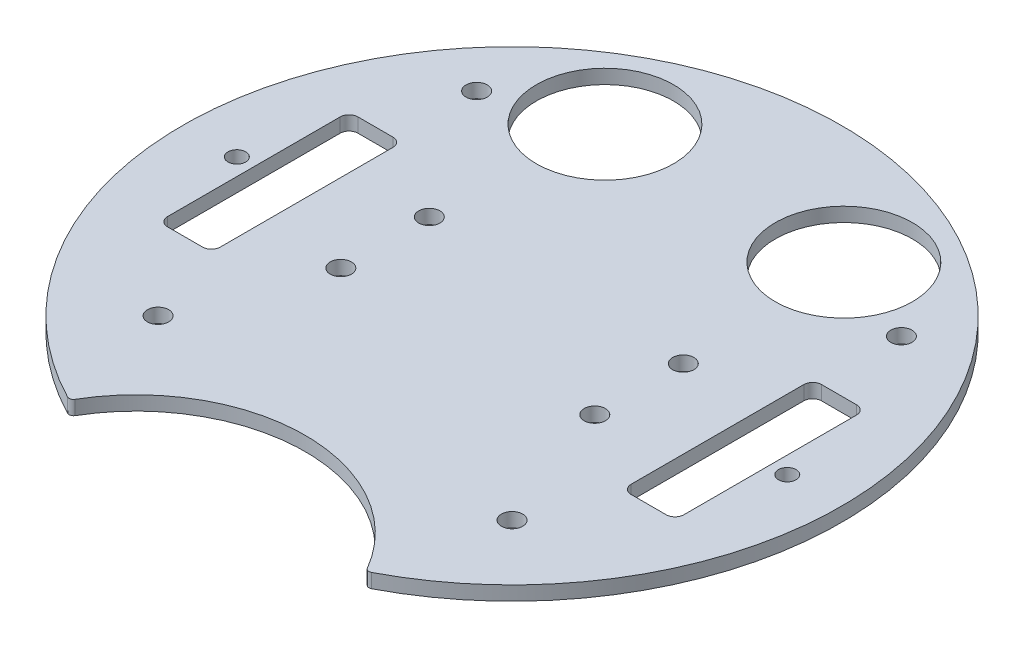
from build123d import *

# Parameters (mm, degrees)
BOSS_EXTRUDE1_DEPTH = 3.2
SKETCH2_W           = 10.76
SKETCH2_H           = 41.868700306
CUT_EXTRUDE1_DEPTH  = 106.40749499
SKETCH3_R           = 2
SKETCH3_R_2         = 2.4
CUT_EXTRUDE2_DEPTH  = 106.40749499
SKETCH4_R           = 15
CUT_EXTRUDE3_DEPTH  = 106.40749499
CUT_EXTRUDE4_DEPTH  = 106.40749499
SKETCH6_R           = 2.4
CUT_EXTRUDE5_DEPTH  = 106.40749499
SKETCH8_R           = 15.5
CUT_EXTRUDE6_DEPTH  = 106.40749499


with BuildPart() as part:
    # Sketch1 → Boss-Extrude1 (new body)
    with BuildSketch(Plane(origin=(0, 0, 0), x_dir=(1, 0, 0), z_dir=(0, 1, 0))):
        with BuildLine():
            ThreePointArc((34.36030176, -66.103098739), (0, 74.5), (-34.36030176, -66.103098739))
            ThreePointArc((-34.36030176, -66.103098739), (-33.621222066, -66.176428208), (-33.035418582, -65.71986465))
            ThreePointArc((-33.035418582, -65.71986465), (0, -46.75), (33.035418582, -65.71986465))
            ThreePointArc((33.035418582, -65.71986465), (33.621222066, -66.176428208), (34.36030176, -66.103098739))
        make_face()
    extrude(amount=BOSS_EXTRUDE1_DEPTH)

    # Sketch2 → Cut-Extrude1 (cut, through all)
    with BuildSketch(Plane(origin=(0, 3.2, 0), x_dir=(1, 0, 0), z_dir=(0, 1, 0))):
        with Locations((-52.39, 0)):
            Rectangle(SKETCH2_W, SKETCH2_H)
        with Locations((52.39, 0)):
            Rectangle(SKETCH2_W, SKETCH2_H)
    extrude(amount=-CUT_EXTRUDE1_DEPTH, mode=Mode.SUBTRACT)

    # Sketch3 → Cut-Extrude2 (cut, through all)
    with BuildSketch(Plane.XZ):
        with Locations(Location((-62.2, 0, 0), (0, 0, 270))):
            Circle(SKETCH3_R)
        with Locations(Location((-28.700738686, 10, 0), (0, 0, 270))):
            Circle(SKETCH3_R_2)
        with Locations(Location((-28.700738686, -10, 0), (0, 0, 270))):
            Circle(SKETCH3_R_2)
        with Locations(Location((28.700738686, -10, 0), (0, 0, 90))):
            Circle(SKETCH3_R_2)
        with Locations(Location((28.700738686, 10, 0), (0, 0, 90))):
            Circle(SKETCH3_R_2)
        with Locations(Location((62.2, 0, 0), (0, 0, 90))):
            Circle(SKETCH3_R)
    extrude(amount=-CUT_EXTRUDE2_DEPTH, mode=Mode.SUBTRACT)

    # Sketch4 → Cut-Extrude3 (cut, through all)
    with BuildSketch(Plane(origin=(0, 3.2, 0), x_dir=(1, 0, 0), z_dir=(0, 1, 0))):
        with Locations(Location((-27, 48, 0), (0, 0, 270))):
            Circle(SKETCH4_R)
        with Locations(Location((27, 48, 0), (0, 0, 90))):
            Circle(SKETCH4_R)
    extrude(amount=-CUT_EXTRUDE3_DEPTH, mode=Mode.SUBTRACT)

    # Sketch5 → Cut-Extrude4 (cut, through all)
    with BuildSketch(Plane(origin=(0, 3.2, 0), x_dir=(1, 0, 0), z_dir=(0, 1, 0))):
        with BuildLine():
            Line((-56.355786438, 21.520136591), (-48.424213562, 21.520136591))
            ThreePointArc((-48.424213562, 21.520136591), (-47.01, 20.934350153), (-46.424213562, 19.520136591))
            Line((-46.424213562, 19.520136591), (-46.424213562, -19.520136591))
            ThreePointArc((-46.424213562, -19.520136591), (-47.01, -20.934350153), (-48.424213562, -21.520136591))
            Line((-48.424213562, -21.520136591), (-56.355786438, -21.520136591))
            ThreePointArc((-56.355786438, -21.520136591), (-57.77, -20.934350153), (-58.355786438, -19.520136591))
            Line((-58.355786438, -19.520136591), (-58.355786438, 19.520136591))
            ThreePointArc((-58.355786438, 19.520136591), (-57.77, 20.934350153), (-56.355786438, 21.520136591))
        make_face()
        with BuildLine():
            Line((46.424213562, 19.520136591), (46.424213562, -19.520136591))
            ThreePointArc((46.424213562, -19.520136591), (47.01, -20.934350153), (48.424213562, -21.520136591))
            Line((48.424213562, -21.520136591), (56.355786438, -21.520136591))
            ThreePointArc((56.355786438, -21.520136591), (57.77, -20.934350153), (58.355786438, -19.520136591))
            Line((58.355786438, -19.520136591), (58.355786438, 19.520136591))
            ThreePointArc((58.355786438, 19.520136591), (57.77, 20.934350153), (56.355786438, 21.520136591))
            Line((56.355786438, 21.520136591), (48.424213562, 21.520136591))
            ThreePointArc((48.424213562, 21.520136591), (47.01, 20.934350153), (46.424213562, 19.520136591))
        make_face()
    extrude(amount=-CUT_EXTRUDE4_DEPTH, mode=Mode.SUBTRACT)

    # Sketch6 → Cut-Extrude5 (cut, through all)
    with BuildSketch(Plane(origin=(0, 3.2, 0), x_dir=(1, 0, 0), z_dir=(0, 1, 0))):
        with Locations(Location((48, 40, 0), (0, 0, 270))):
            Circle(SKETCH6_R)
        with Locations(Location((-40, -40, 0), (0, 0, 270))):
            Circle(SKETCH6_R)
        with Locations(Location((40, -40, 0), (0, 0, 90))):
            Circle(SKETCH6_R)
        with Locations(Location((-48, 40, 0), (0, 0, 90))):
            Circle(SKETCH6_R)
    extrude(amount=-CUT_EXTRUDE5_DEPTH, mode=Mode.SUBTRACT)

    # Sketch8 → Cut-Extrude6 (cut, through all)
    with BuildSketch(Plane(origin=(0, 3.2, 0), x_dir=(1, 0, 0), z_dir=(0, 1, 0))):
        with Locations(Location((-27, 48, 0), (0, 0, 270))):
            Circle(SKETCH8_R)
        with Locations(Location((27, 48, 0), (0, 0, 270))):
            Circle(SKETCH8_R)
    extrude(amount=-CUT_EXTRUDE6_DEPTH, mode=Mode.SUBTRACT)


solid = part.part
